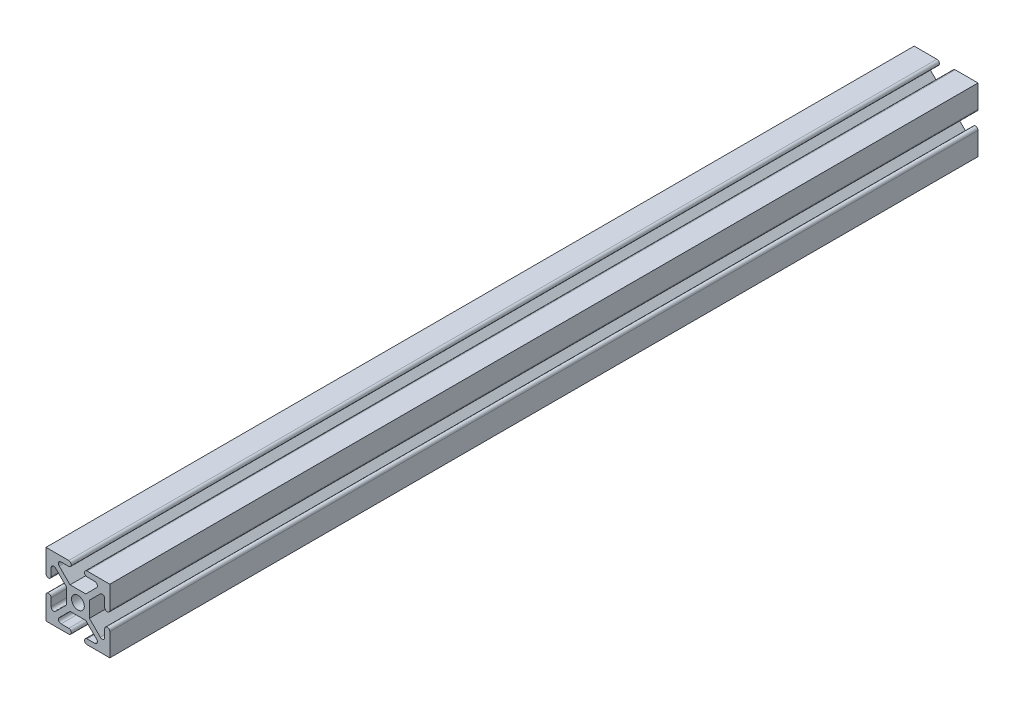
from build123d import *

# Parameters (mm, degrees)
SKETCH2_R           = 2.5
BOSS_EXTRUDE1_DEPTH = 340


with BuildPart() as part:
    # Sketch2 → Boss-Extrude1 (new body)
    with BuildSketch(Plane.XY):
        with BuildLine():
            ThreePointArc((16.100505063, 0), (15.100505063, 1), (16.100505063, 2))
            Line((16.100505063, 2), (19.100505063, 2))
            ThreePointArc((19.100505063, 2), (20.05158107, 2.635488671), (19.828427125, 3.757359313))
            Line((19.828427125, 3.757359313), (15.585786438, 8))
            Line((15.585786438, 8), (12.5, 8))
            Line((12.5, 8), (9.414213562, 8))
            Line((9.414213562, 8), (5.171572875, 3.757359313))
            ThreePointArc((5.171572875, 3.757359313), (4.94841893, 2.635488671), (5.899494937, 2))
            Line((5.899494937, 2), (8.899494937, 2))
            ThreePointArc((8.899494937, 2), (9.899494937, 1), (8.899494937, 0))
            Line((8.899494937, 0), (0, 0))
            Line((0, 0), (0, 8.899494937))
            ThreePointArc((0, 8.899494937), (1, 9.899494937), (2, 8.899494937))
            Line((2, 8.899494937), (2, 5.899494937))
            ThreePointArc((2, 5.899494937), (2.635488671, 4.94841893), (3.757359313, 5.171572875))
            Line((3.757359313, 5.171572875), (8, 9.414213562))
            Line((8, 9.414213562), (8, 12.5))
            Line((8, 12.5), (8, 15.585786438))
            Line((8, 15.585786438), (3.757359313, 19.828427125))
            ThreePointArc((3.757359313, 19.828427125), (2.635488671, 20.05158107), (2, 19.100505063))
            Line((2, 19.100505063), (2, 16.100505063))
            ThreePointArc((2, 16.100505063), (1, 15.100505063), (0, 16.100505063))
            Line((0, 16.100505063), (0, 25))
            Line((0, 25), (8.899494937, 25))
            ThreePointArc((8.899494937, 25), (9.899494937, 24), (8.899494937, 23))
            Line((8.899494937, 23), (5.899494937, 23))
            ThreePointArc((5.899494937, 23), (4.94841893, 22.364511329), (5.171572875, 21.242640687))
            Line((5.171572875, 21.242640687), (9.414213562, 17))
            Line((9.414213562, 17), (12.5, 17))
            Line((12.5, 17), (15.585786438, 17))
            Line((15.585786438, 17), (19.828427125, 21.242640687))
            ThreePointArc((19.828427125, 21.242640687), (20.05158107, 22.364511329), (19.100505063, 23))
            Line((19.100505063, 23), (16.100505063, 23))
            ThreePointArc((16.100505063, 23), (15.100505063, 24), (16.100505063, 25))
            Line((16.100505063, 25), (25, 25))
            Line((25, 25), (25, 16.100505063))
            ThreePointArc((25, 16.100505063), (24, 15.100505063), (23, 16.100505063))
            Line((23, 16.100505063), (23, 19.100505063))
            ThreePointArc((23, 19.100505063), (22.364511329, 20.05158107), (21.242640687, 19.828427125))
            Line((21.242640687, 19.828427125), (17, 15.585786438))
            Line((17, 15.585786438), (17, 12.5))
            Line((17, 12.5), (17, 9.414213562))
            Line((17, 9.414213562), (21.242640687, 5.171572875))
            ThreePointArc((21.242640687, 5.171572875), (22.364511329, 4.94841893), (23, 5.899494937))
            Line((23, 5.899494937), (23, 8.899494937))
            ThreePointArc((23, 8.899494937), (24, 9.899494937), (25, 8.899494937))
            Line((25, 8.899494937), (25, 0))
            Line((25, 0), (16.100505063, 0))
        make_face()
        with Locations((12.5, 12.5)):
            Circle(SKETCH2_R, mode=Mode.SUBTRACT)
    extrude(amount=BOSS_EXTRUDE1_DEPTH)


solid = part.part
